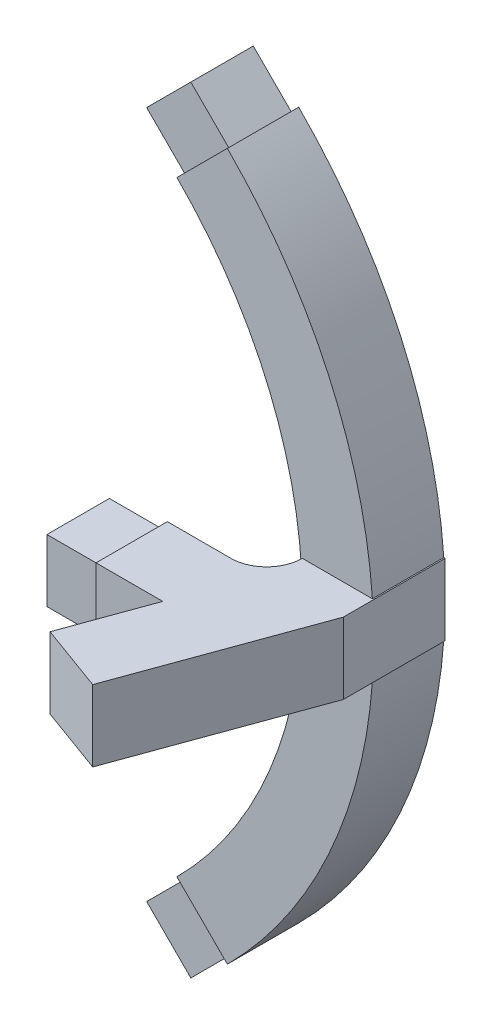
from build123d import *

# Parameters (mm, degrees)
BOSS_EXTRUDE1_DEPTH  = 25.4
BOSS_EXTRUDE7_DEPTH  = 25.4
SKETCH5_W            = 22.225
SKETCH5_H            = 22.225
BOSS_EXTRUDE10_DEPTH = 19.05
SKETCH6_W            = 22.225
SKETCH6_H            = 22.225
BOSS_EXTRUDE11_DEPTH = 19.05
SKETCH7_W            = 22.225
SKETCH7_H            = 22.225
BOSS_EXTRUDE13_DEPTH = 19.05


with BuildPart() as part:
    # Sketch1 → Boss-Extrude1 (new body)
    with BuildSketch(Plane(origin=(0, 0, 0), x_dir=(1, 0, 0), z_dir=(0, 1, 0))):
        with BuildLine():
            Line((-50.8, 0), (-27.030115421, 0))
            Line((-27.030115421, 0), (-37.735458494, -29.41268836))
            Line((-37.735458494, -29.41268836), (-13.867265926, -38.1))
            Line((-13.867265926, -38.1), (9.925939517, 27.27129469))
            Line((9.925939517, 27.27129469), (9.925939517, 38.1))
            Line((9.925939517, 38.1), (-15.474060483, 38.1))
            ThreePointArc((-15.474060483, 38.1), (-19.193804362, 29.119743879), (-28.174060483, 25.4))
            Line((-28.174060483, 25.4), (-50.8, 25.4))
            Line((-50.8, 25.4), (-50.8, 0))
        make_face()
    extrude(amount=BOSS_EXTRUDE1_DEPTH)

    # Sketch4 → Boss-Extrude7 (add)
    with BuildSketch(Plane(origin=(0, 0, -38.1), x_dir=(-1, 0, 0), z_dir=(0, 0, -1))):
        with BuildLine():
            Line((-9.925939517, 25.4), (-9.925939517, 0))
            Line((-9.925939517, 0), (-9.471788073, 0))
            ThreePointArc((-9.471788073, 0), (6.144801457, -61.168036219), (42.150474788, -113.023585695))
            Line((42.150474788, -113.023585695), (60.11098703, -95.063073453))
            ThreePointArc((60.11098703, -95.063073453), (15.474060483, 12.7), (60.11098703, 120.463073453))
            Line((60.11098703, 120.463073453), (42.150474788, 138.423585695))
            ThreePointArc((42.150474788, 138.423585695), (6.144801457, 86.568036219), (-9.471788073, 25.4))
            Line((-9.471788073, 25.4), (-9.925939517, 25.4))
        make_face()
    extrude(amount=BOSS_EXTRUDE7_DEPTH)

    # Sketch5 → Boss-Extrude10 (add)
    with BuildSketch(Plane(origin=(-90.287030241, 90.287030241, 0), x_dir=(0, 0, 1), z_dir=(-0.7071067811865479, 0.7071067811865472, 0))):
        with Locations((-50.8, 55.375369568)):
            Rectangle(SKETCH5_W, SKETCH5_H)
    extrude(amount=BOSS_EXTRUDE10_DEPTH)

    # Sketch6 → Boss-Extrude11 (add)
    with BuildSketch(Plane(origin=(-77.587030241, -77.587030241, 0), x_dir=(0, 0, 1), z_dir=(-0.7071067811865478, -0.7071067811865472, 0))):
        with Locations((-50.8, -37.414857326)):
            Rectangle(SKETCH6_W, SKETCH6_H)
    extrude(amount=BOSS_EXTRUDE11_DEPTH)

    # Sketch7 → Boss-Extrude13 (add)
    with BuildSketch(Plane.ZY.offset(50.8)):
        with Locations((-12.7, 12.7)):
            Rectangle(SKETCH7_W, SKETCH7_H)
    extrude(amount=BOSS_EXTRUDE13_DEPTH)


solid = part.part
